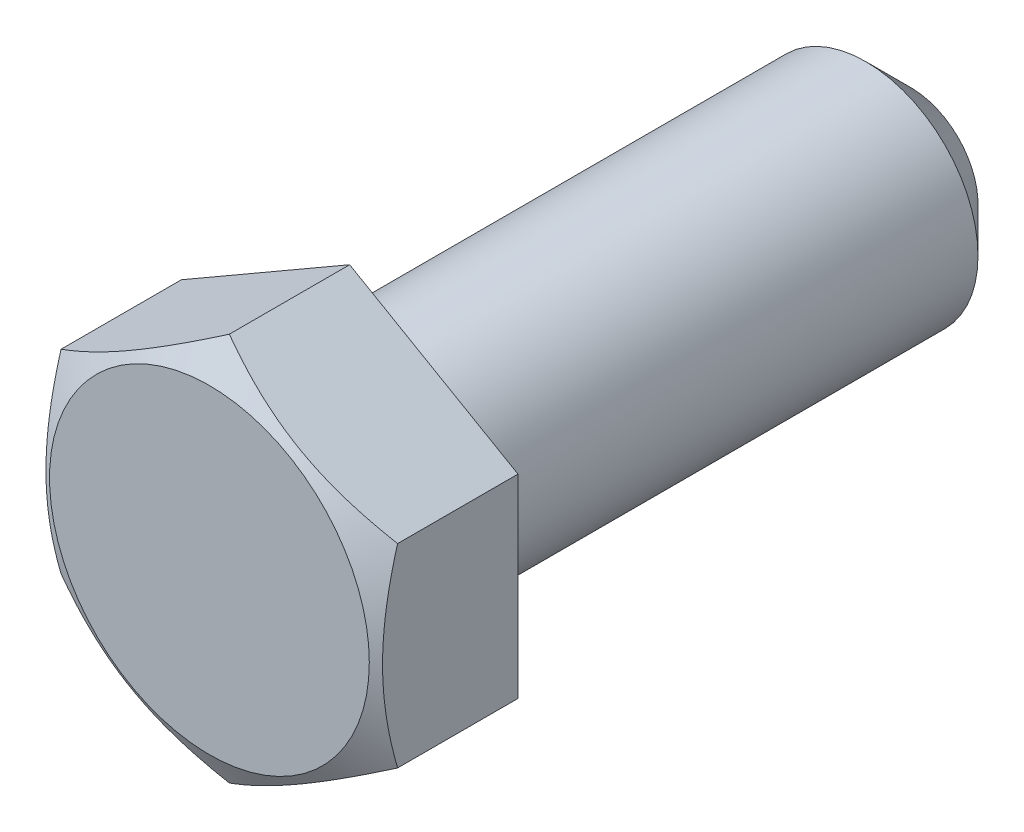
from build123d import *

# Parameters (mm, degrees)
EXTRUDE_339_DEPTH     = 5
SKETCH_D_OUTSIDE_W    = 52.442
SKETCH_D_OUTSIDE_H    = 54.298
SKETCH_D_OUTSIDE_R    = 5.7
CUT_EXTRUDE_383_DEPTH = 10
CUT_EXTRUDE_383_DRAFT = -60
SKETCH_418_R          = 4
EXTRUDE_481_DEPTH     = 20
CHAMFER_526_SIZE      = 1.6


with BuildPart() as part:
    # Sketch 332 → Extrude 339 (new body)
    with BuildSketch(Plane.XY):
        Polygon((0, -6.92820323), (6, -3.464101615), (6, 3.464101615), (0, 6.92820323), (-6, 3.464101615), (-6, -3.464101615), align=None)
    extrude(amount=EXTRUDE_339_DEPTH)


with BuildPart() as cut_extrude_383_tool:
    # D outside → Cut-Extrude 383 (with draft: the straight prism first)
    with BuildSketch(Plane.XY.offset(5)):
        Rectangle(SKETCH_D_OUTSIDE_W, SKETCH_D_OUTSIDE_H)
        Circle(SKETCH_D_OUTSIDE_R, mode=Mode.SUBTRACT)
    extrude(amount=-CUT_EXTRUDE_383_DEPTH)
    # Cut-Extrude 383: the draft: its side faces are tilted about the plane it starts from
    cut_extrude_383_sides = [cut_extrude_383_tool.faces().sort_by_distance(p)[0] for p in [
        (0, -27.149, 0),
        (26.221, 0, 0),
        (0, 27.149, 0),
        (-26.221, 0, 0),
        (-5.7, 0, 0),
    ]]
    draft(cut_extrude_383_sides, Plane.XY.offset(5), CUT_EXTRUDE_383_DRAFT)


with BuildPart() as part_1:
    add(part.part)

    # Cut-Extrude 383: cut by cut_extrude_383_tool
    add(cut_extrude_383_tool.part, mode=Mode.SUBTRACT)

    # Sketch 418 → Extrude 481 (add)
    with BuildSketch(Plane(origin=(0, 0, 0), x_dir=(-1, 0, 0), z_dir=(0, 0, -1))):
        Circle(SKETCH_418_R)
    extrude(amount=EXTRUDE_481_DEPTH)

    # Chamfer 526
    chamfer_526_edges = [part_1.edges().sort_by_distance(p)[0] for p in [
        (4, 0, -20),
    ]]
    chamfer(chamfer_526_edges, length=CHAMFER_526_SIZE)


solid = part_1.part
